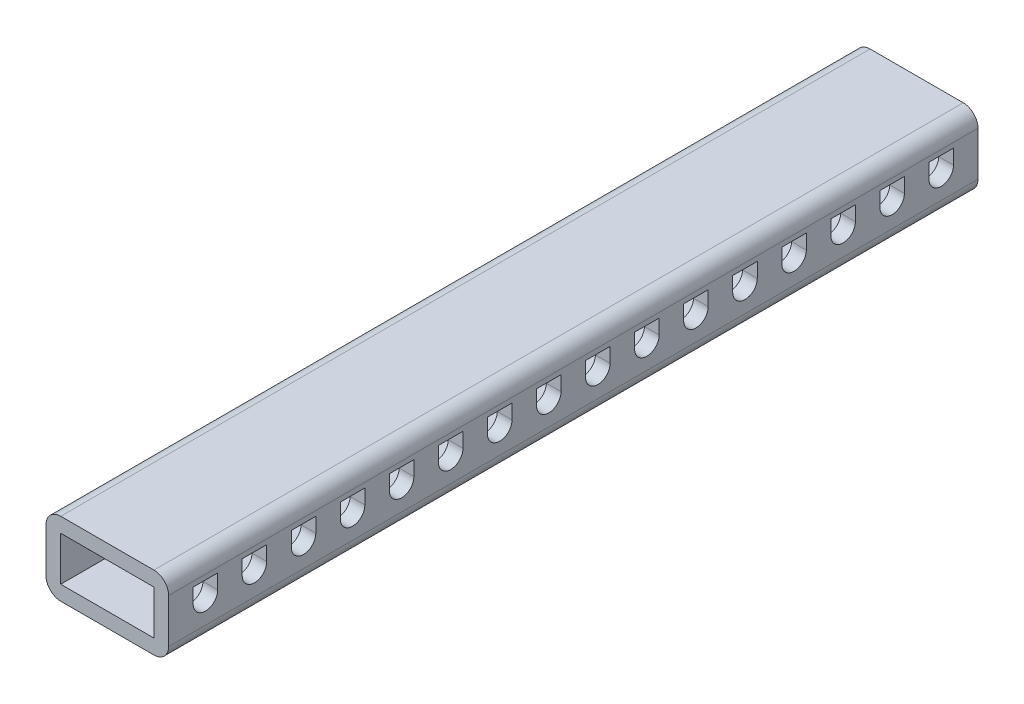
from build123d import *

# Parameters (mm, degrees)
SKETCH1_W           = 25
SKETCH1_H           = 15
BOSS_EXTRUDE1_DEPTH = 165
SKETCH2_W           = 19
SKETCH2_H           = 9
CUT_EXTRUDE1_DEPTH  = 263
CUT_EXTRUDE2_DEPTH  = 263
FILLET1_R           = 3


with BuildPart() as part:
    # Sketch1 → Boss-Extrude1 (new body)
    with BuildSketch(Plane.XY):
        Rectangle(SKETCH1_W, SKETCH1_H)
    extrude(amount=BOSS_EXTRUDE1_DEPTH)

    # Sketch2 → Cut-Extrude1 (cut)
    with BuildSketch(Plane.XY.offset(165)):
        Rectangle(SKETCH2_W, SKETCH2_H)
    extrude(amount=-CUT_EXTRUDE1_DEPTH, mode=Mode.SUBTRACT)

    # Sketch3 → Cut-Extrude2 (cut)
    with BuildSketch(Plane(origin=(12.5, 0, 0), x_dir=(0, 0, -1), z_dir=(1, 0, 0))):
        with BuildLine():
            Line((-160, 3.5), (-160, 0.5))
            ThreePointArc((-160, 0.5), (-157.5, -2), (-155, 0.5))
            Line((-155, 0.5), (-155, 3.5))
            Line((-155, 3.5), (-160, 3.5))
        make_face()
        with BuildLine():
            ThreePointArc((-145, 0.5), (-147.5, -2), (-150, 0.5))
            Line((-150, 0.5), (-150, 3.5))
            Line((-150, 3.5), (-145, 3.5))
            Line((-145, 3.5), (-145, 0.5))
        make_face()
        with BuildLine():
            Line((-140, 3.5), (-140, 0.5))
            ThreePointArc((-140, 0.5), (-137.5, -2), (-135, 0.5))
            Line((-135, 0.5), (-135, 3.5))
            Line((-135, 3.5), (-140, 3.5))
        make_face()
        with BuildLine():
            ThreePointArc((-125, 0.5), (-127.5, -2), (-130, 0.5))
            Line((-130, 0.5), (-130, 3.5))
            Line((-130, 3.5), (-125, 3.5))
            Line((-125, 3.5), (-125, 0.5))
        make_face()
        with BuildLine():
            Line((-120, 3.5), (-120, 0.5))
            ThreePointArc((-120, 0.5), (-117.5, -2), (-115, 0.5))
            Line((-115, 0.5), (-115, 3.5))
            Line((-115, 3.5), (-120, 3.5))
        make_face()
        with BuildLine():
            ThreePointArc((-105, 0.5), (-107.5, -2), (-110, 0.5))
            Line((-110, 0.5), (-110, 3.5))
            Line((-110, 3.5), (-105, 3.5))
            Line((-105, 3.5), (-105, 0.5))
        make_face()
        with BuildLine():
            Line((-100, 3.5), (-100, 0.5))
            ThreePointArc((-100, 0.5), (-97.5, -2), (-95, 0.5))
            Line((-95, 0.5), (-95, 3.5))
            Line((-95, 3.5), (-100, 3.5))
        make_face()
        with BuildLine():
            ThreePointArc((-85, 0.5), (-87.5, -2), (-90, 0.5))
            Line((-90, 0.5), (-90, 3.5))
            Line((-90, 3.5), (-85, 3.5))
            Line((-85, 3.5), (-85, 0.5))
        make_face()
        with BuildLine():
            Line((-80, 3.5), (-80, 0.5))
            ThreePointArc((-80, 0.5), (-77.5, -2), (-75, 0.5))
            Line((-75, 0.5), (-75, 3.5))
            Line((-75, 3.5), (-80, 3.5))
        make_face()
        with BuildLine():
            ThreePointArc((-65, 0.5), (-67.5, -2), (-70, 0.5))
            Line((-70, 0.5), (-70, 3.5))
            Line((-70, 3.5), (-65, 3.5))
            Line((-65, 3.5), (-65, 0.5))
        make_face()
        with BuildLine():
            Line((-60, 3.5), (-60, 0.5))
            ThreePointArc((-60, 0.5), (-57.5, -2), (-55, 0.5))
            Line((-55, 0.5), (-55, 3.5))
            Line((-55, 3.5), (-60, 3.5))
        make_face()
        with BuildLine():
            ThreePointArc((-45, 0.5), (-47.5, -2), (-50, 0.5))
            Line((-50, 0.5), (-50, 3.5))
            Line((-50, 3.5), (-45, 3.5))
            Line((-45, 3.5), (-45, 0.5))
        make_face()
        with BuildLine():
            Line((-40, 3.5), (-40, 0.5))
            ThreePointArc((-40, 0.5), (-37.5, -2), (-35, 0.5))
            Line((-35, 0.5), (-35, 3.5))
            Line((-35, 3.5), (-40, 3.5))
        make_face()
        with BuildLine():
            ThreePointArc((-25, 0.5), (-27.5, -2), (-30, 0.5))
            Line((-30, 0.5), (-30, 3.5))
            Line((-30, 3.5), (-25, 3.5))
            Line((-25, 3.5), (-25, 0.5))
        make_face()
        with BuildLine():
            Line((-20, 3.5), (-20, 0.5))
            ThreePointArc((-20, 0.5), (-17.5, -2), (-15, 0.5))
            Line((-15, 0.5), (-15, 3.5))
            Line((-15, 3.5), (-20, 3.5))
        make_face()
        with BuildLine():
            ThreePointArc((-5, 0.5), (-7.5, -2), (-10, 0.5))
            Line((-10, 0.5), (-10, 3.5))
            Line((-10, 3.5), (-5, 3.5))
            Line((-5, 3.5), (-5, 0.5))
        make_face()
        with BuildLine():
            Line((0, 3.5), (0, 0.5))
            ThreePointArc((0, 0.5), (2.5, -2), (5, 0.5))
            Line((5, 0.5), (5, 3.5))
            Line((5, 3.5), (0, 3.5))
        make_face()
        with BuildLine():
            ThreePointArc((15, 0.5), (12.5, -2), (10, 0.5))
            Line((10, 0.5), (10, 3.5))
            Line((10, 3.5), (15, 3.5))
            Line((15, 3.5), (15, 0.5))
        make_face()
        with BuildLine():
            Line((20, 3.5), (20, 0.5))
            ThreePointArc((20, 0.5), (22.5, -2), (25, 0.5))
            Line((25, 0.5), (25, 3.5))
            Line((25, 3.5), (20, 3.5))
        make_face()
        with BuildLine():
            ThreePointArc((35, 0.5), (32.5, -2), (30, 0.5))
            Line((30, 0.5), (30, 3.5))
            Line((30, 3.5), (35, 3.5))
            Line((35, 3.5), (35, 0.5))
        make_face()
        with BuildLine():
            Line((40, 3.5), (40, 0.5))
            ThreePointArc((40, 0.5), (42.5, -2), (45, 0.5))
            Line((45, 0.5), (45, 3.5))
            Line((45, 3.5), (40, 3.5))
        make_face()
        with BuildLine():
            ThreePointArc((55, 0.5), (52.5, -2), (50, 0.5))
            Line((50, 0.5), (50, 3.5))
            Line((50, 3.5), (55, 3.5))
            Line((55, 3.5), (55, 0.5))
        make_face()
    extrude(amount=-CUT_EXTRUDE2_DEPTH, mode=Mode.SUBTRACT)

    # Fillet1
    fillet1_edges = [part.edges().sort_by_distance(p)[0] for p in [
        (12.5, -7.5, 82.5),
        (-12.5, -7.5, 82.5),
        (-12.5, 7.5, 82.5),
        (12.5, 7.5, 82.5),
    ]]
    fillet(fillet1_edges, radius=FILLET1_R)


solid = part.part
